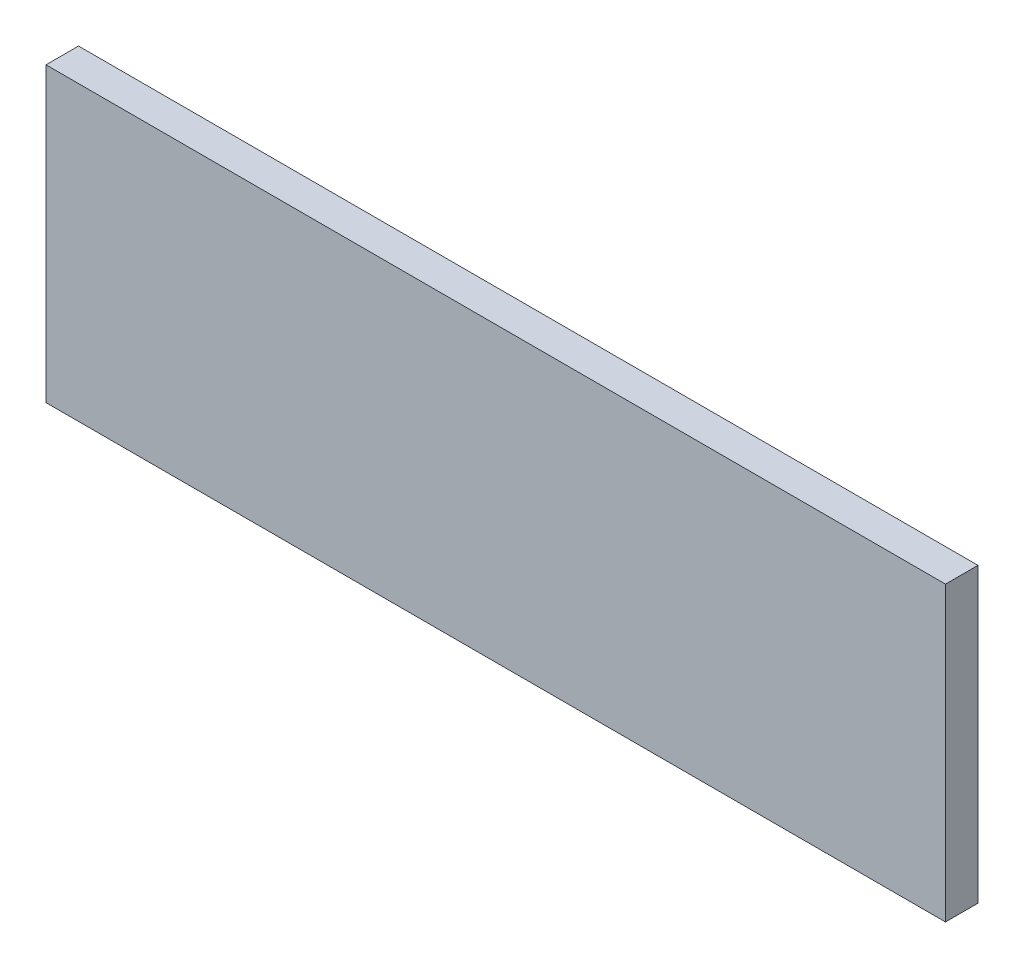
from build123d import *

# Parameters (mm, degrees)
SKETCH1_W           = 41.5
SKETCH1_H           = 13.5
BOSS_EXTRUDE1_DEPTH = 1.5


with BuildPart() as part:
    # Sketch1 → Boss-Extrude1 (new body)
    with BuildSketch(Plane.XY):
        with Locations((20.75, 6.75)):
            Rectangle(SKETCH1_W, SKETCH1_H)
    extrude(amount=BOSS_EXTRUDE1_DEPTH)


solid = part.part
